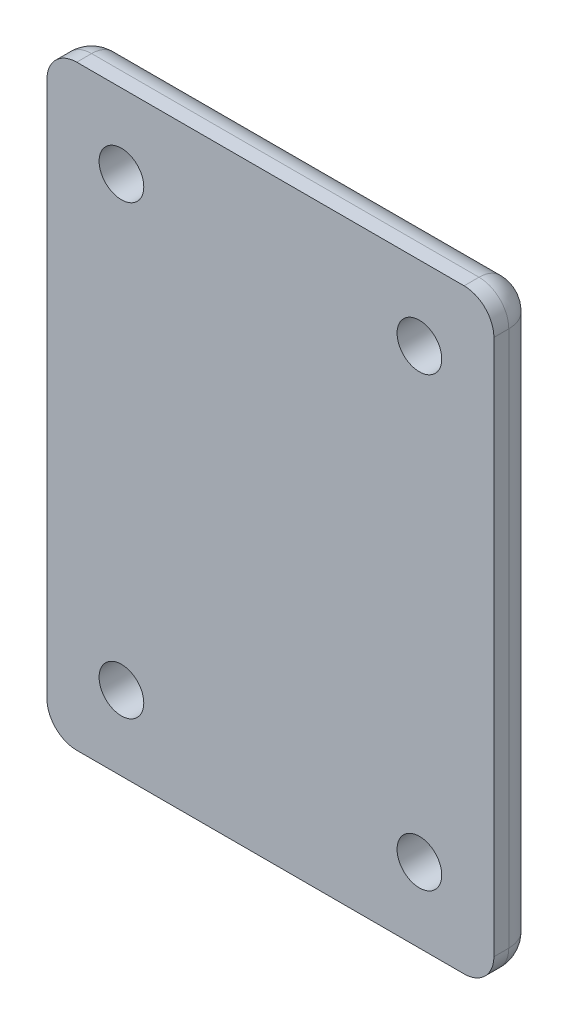
from build123d import *

# Parameters (mm, degrees)
SKETCH_1_W          = 30
SKETCH_1_H          = 40
EXTRUDE_1_DEPTH     = 3
SKETCH_2_R          = 1.5
CUT_EXTRUDE_1_DEPTH = 10
FILLET_1_R          = 2


with BuildPart() as part:
    # 草图1 → 凸台-拉伸1 (new body)
    with BuildSketch(Plane.XY):
        Rectangle(SKETCH_1_W, SKETCH_1_H)
    extrude(amount=EXTRUDE_1_DEPTH)

    # 草图2 → 切除-拉伸1 (cut)
    with BuildSketch(Plane.XY.offset(3)):
        with Locations((10, 15)):
            Circle(SKETCH_2_R)
        with Locations((-10, 15)):
            Circle(SKETCH_2_R)
        with Locations((10, -15)):
            Circle(SKETCH_2_R)
        with Locations((-10, -15)):
            Circle(SKETCH_2_R)
    extrude(amount=-CUT_EXTRUDE_1_DEPTH, mode=Mode.SUBTRACT)

    # 圆角1
    fillet_1_edges = [part.edges().sort_by_distance(p)[0] for p in [
        (0, -20, 0),
        (-15, 0, 0),
        (0, 20, 0),
        (15, 0, 0),
        (15, -20, 1.5),
        (-15, -20, 1.5),
        (-15, 20, 1.5),
        (15, 20, 1.5),
    ]]
    fillet(fillet_1_edges, radius=FILLET_1_R)


solid = part.part
